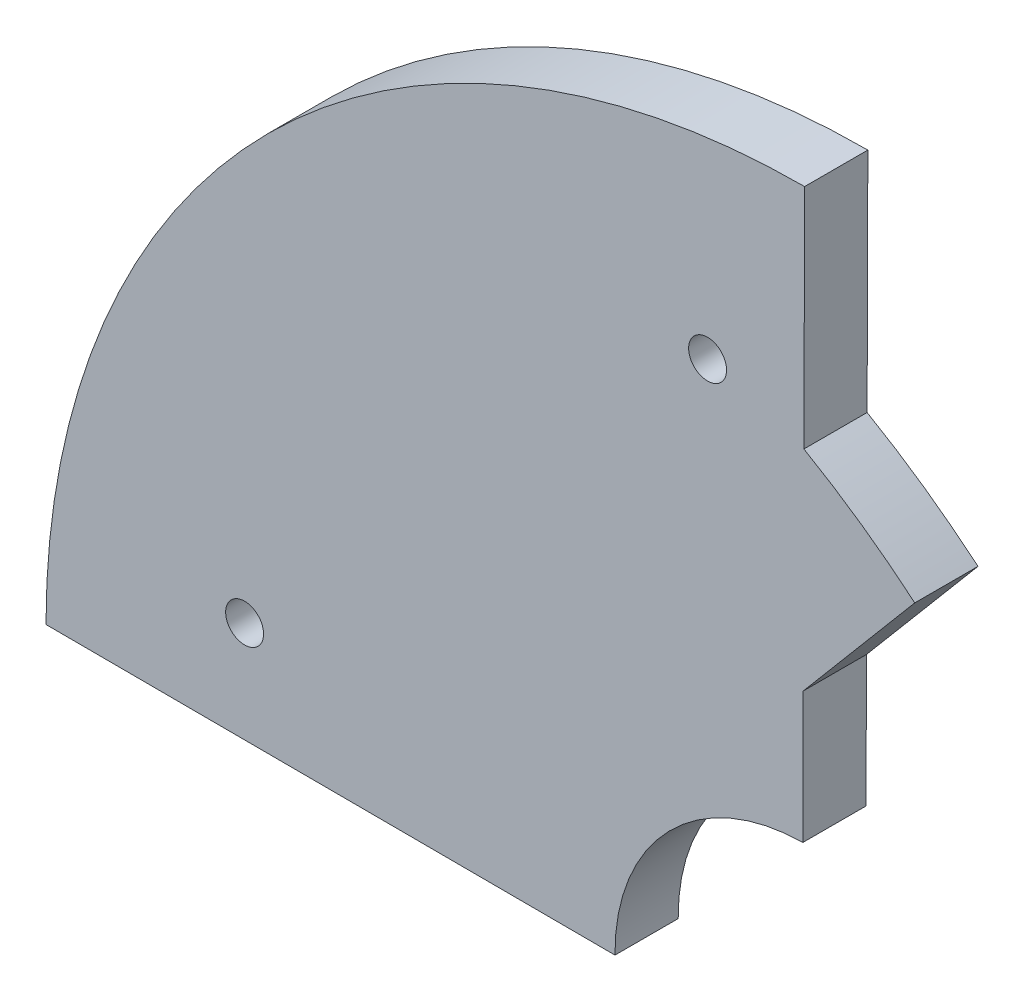
from build123d import *

# Parameters (mm, degrees)
BOSS_EXTRUDE1_DEPTH = 5
SKETCH3_R           = 1.5
CUT_EXTRUDE1_DEPTH  = 5
BOSS_EXTRUDE2_DEPTH = 5


with BuildPart() as part:
    # Sketch2 → Boss-Extrude1 (new body)
    with BuildSketch(Plane.XY):
        with BuildLine():
            Line((-60, 0), (-14.999324285, -0.142376231))
            ThreePointArc((-14.999324285, -0.142376231), (-10.706799113, 10.505448717), (-0.142376231, 14.999324285))
            Line((-0.142376231, 14.999324285), (0, 60))
            ThreePointArc((0, 60), (-42.426406871, 42.426406871), (-60, 0))
        make_face()
    extrude(amount=BOSS_EXTRUDE1_DEPTH)

    # Sketch3 → Cut-Extrude1 (cut)
    with BuildSketch(Plane.XY.offset(5)):
        with Locations((-7.673918476, 44.34084996)):
            Circle(SKETCH3_R)
        with Locations((-44.291404204, 7.954339294)):
            Circle(SKETCH3_R)
    extrude(amount=-CUT_EXTRUDE1_DEPTH, mode=Mode.SUBTRACT)

    # Sketch4 → Boss-Extrude2 (add)
    with BuildSketch(Plane.XY.offset(5)):
        with BuildLine():
            Line((8.712482668, 35.840415418), (-0.109488527, 25.394099488))
            Line((-0.109488527, 25.394099488), (-0.056967441, 41.994372784))
            ThreePointArc((-0.056967441, 41.994372784), (4.465384672, 39.11351402), (8.712482668, 35.840415418))
        make_face()
    extrude(amount=-BOSS_EXTRUDE2_DEPTH)


solid = part.part
